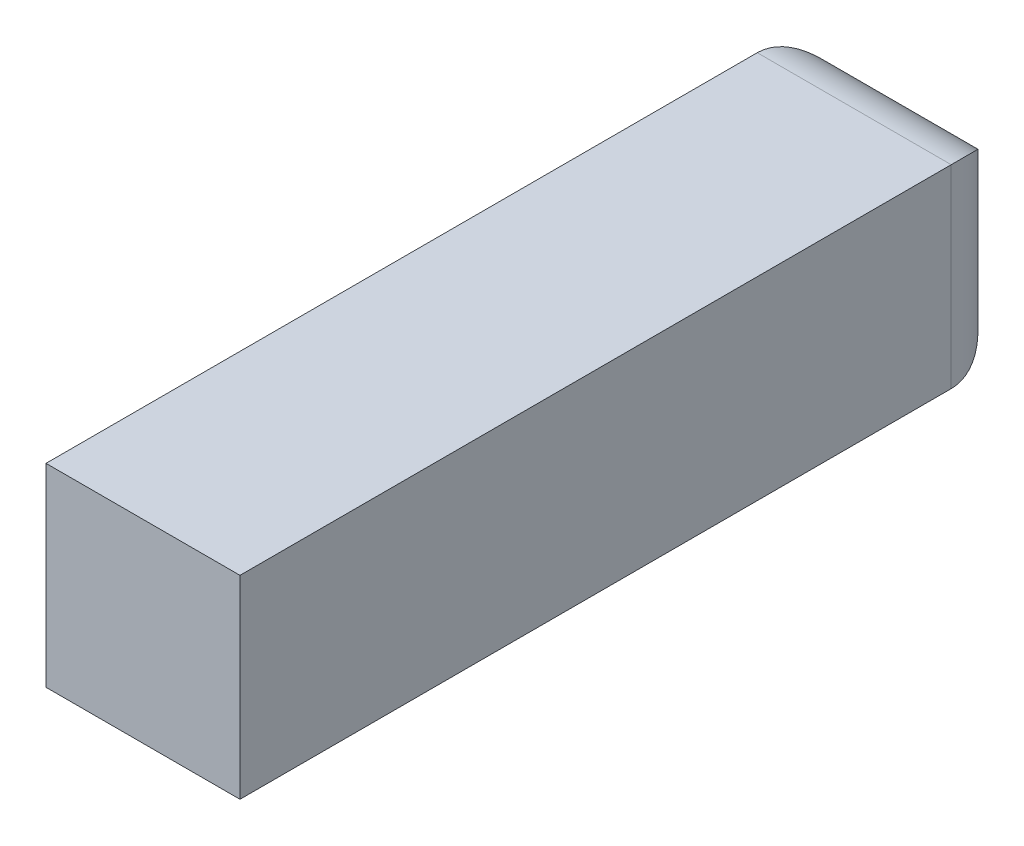
from build123d import *

# Parameters (mm, degrees)
ESQUISSE1_W        = 30
ESQUISSE1_H        = 30
BOSS_EXTRU_1_DEPTH = 120
CONG_2_R           = 10


with BuildPart() as part:
    # Esquisse1 → Boss.-Extru.1 (new body)
    with BuildSketch(Plane.XY):
        Rectangle(ESQUISSE1_W, ESQUISSE1_H)
    extrude(amount=BOSS_EXTRU_1_DEPTH)

    # Congé2
    cong_2_edges = [part.edges().sort_by_distance(p)[0] for p in [
        (0, 15, 0),
        (15, 0, 0),
        (0, -15, 0),
        (-15, 0, 0),
    ]]
    fillet(cong_2_edges, radius=CONG_2_R)


solid = part.part
